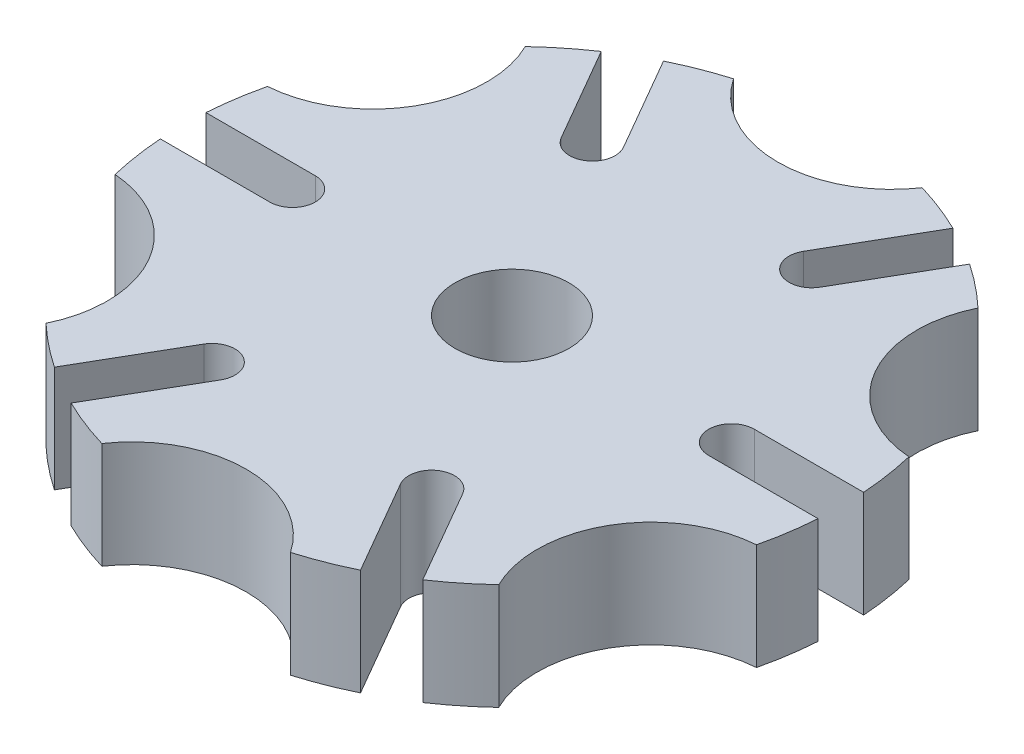
from build123d import *

# Parameters (mm, degrees)
BOSS_EXTRUDE1_DEPTH     = 28
CUT_EXTRUDE1_DEPTH      = 124.299913301
CUT_EXTRUDE1_DEPTH_BACK = 124.299913301
SKETCH2_R               = 15


with BuildPart() as part:
    # Sketch1 → Boss-Extrude1 (new body)
    with BuildSketch(Plane(origin=(0, 0, 0), x_dir=(1, 0, 0), z_dir=(0, 1, 0))):
        with BuildLine():
            Line((34.09833793, -47.060053749), (48.497353619, -71.9998805))
            ThreePointArc((48.497353619, -71.9998805), (54.23905714, -67.779796256), (59.615306076, -63.103021968))
            ThreePointArc((59.615306076, -63.103021968), (60.621778265, -35), (84.456473118, -20.076858532))
            ThreePointArc((84.456473118, -20.076858532), (85.818553991, -13.082503233), (86.602402392, -6))
            Line((86.602402392, -6), (57.804371015, -6))
            ThreePointArc((57.804371015, -6), (51.804371015, 0), (57.804371015, 6))
            Line((57.804371015, 6), (86.602402392, 6))
            ThreePointArc((86.602402392, 6), (85.818553991, 13.082503233), (84.456473118, 20.076858532))
            ThreePointArc((84.456473118, 20.076858532), (60.621778265, 35), (59.615306076, 63.103021968))
            ThreePointArc((59.615306076, 63.103021968), (54.23905714, 67.779796256), (48.497353619, 71.9998805))
            Line((48.497353619, 71.9998805), (34.09833793, 47.060053749))
            ThreePointArc((34.09833793, 47.060053749), (25.902185507, 44.863901326), (23.706033085, 53.060053749))
            Line((23.706033085, 53.060053749), (38.105048773, 77.9998805))
            ThreePointArc((38.105048773, 77.9998805), (31.579496851, 80.862299489), (24.841167042, 83.1798805))
            ThreePointArc((24.841167042, 83.1798805), (0, 70), (-24.841167042, 83.1798805))
            ThreePointArc((-24.841167042, 83.1798805), (-31.579496851, 80.862299489), (-38.105048773, 77.9998805))
            Line((-38.105048773, 77.9998805), (-23.706033085, 53.060053749))
            ThreePointArc((-23.706033085, 53.060053749), (-25.902185507, 44.863901326), (-34.09833793, 47.060053749))
            Line((-34.09833793, 47.060053749), (-48.497353619, 71.9998805))
            ThreePointArc((-48.497353619, 71.9998805), (-54.23905714, 67.779796256), (-59.615306076, 63.103021968))
            ThreePointArc((-59.615306076, 63.103021968), (-60.621778265, 35), (-84.456473118, 20.076858532))
            ThreePointArc((-84.456473118, 20.076858532), (-85.818553991, 13.082503233), (-86.602402392, 6))
            Line((-86.602402392, 6), (-57.804371015, 6))
            ThreePointArc((-57.804371015, 6), (-51.804371015, 0), (-57.804371015, -6))
            Line((-57.804371015, -6), (-86.602402392, -6))
            ThreePointArc((-86.602402392, -6), (-85.818553991, -13.082503233), (-84.456473118, -20.076858532))
            ThreePointArc((-84.456473118, -20.076858532), (-60.621778265, -35), (-59.615306076, -63.103021968))
            ThreePointArc((-59.615306076, -63.103021968), (-54.23905714, -67.779796256), (-48.497353619, -71.9998805))
            Line((-48.497353619, -71.9998805), (-34.09833793, -47.060053749))
            ThreePointArc((-34.09833793, -47.060053749), (-25.902185507, -44.863901326), (-23.706033085, -53.060053749))
            Line((-23.706033085, -53.060053749), (-38.105048773, -77.9998805))
            ThreePointArc((-38.105048773, -77.9998805), (-31.579496851, -80.862299489), (-24.841167042, -83.1798805))
            ThreePointArc((-24.841167042, -83.1798805), (0, -70), (24.841167042, -83.1798805))
            ThreePointArc((24.841167042, -83.1798805), (31.579496851, -80.862299489), (38.105048773, -77.9998805))
            Line((38.105048773, -77.9998805), (23.706033085, -53.060053749))
            ThreePointArc((23.706033085, -53.060053749), (25.902185507, -44.863901326), (34.09833793, -47.060053749))
        make_face()
    extrude(amount=BOSS_EXTRUDE1_DEPTH)

    # Sketch2 → Cut-Extrude1 (cut, two sides: drawn at the far end of the back side and taken through both)
    with BuildSketch(Plane(origin=(0, 28, 0), x_dir=(1, 0, 0), z_dir=(0, 1, 0)).offset(-CUT_EXTRUDE1_DEPTH_BACK)):
        with Locations(Location((0, 0, 0), (0, 0, 270))):
            Circle(SKETCH2_R)
    extrude(amount=CUT_EXTRUDE1_DEPTH + CUT_EXTRUDE1_DEPTH_BACK, mode=Mode.SUBTRACT)


solid = part.part
